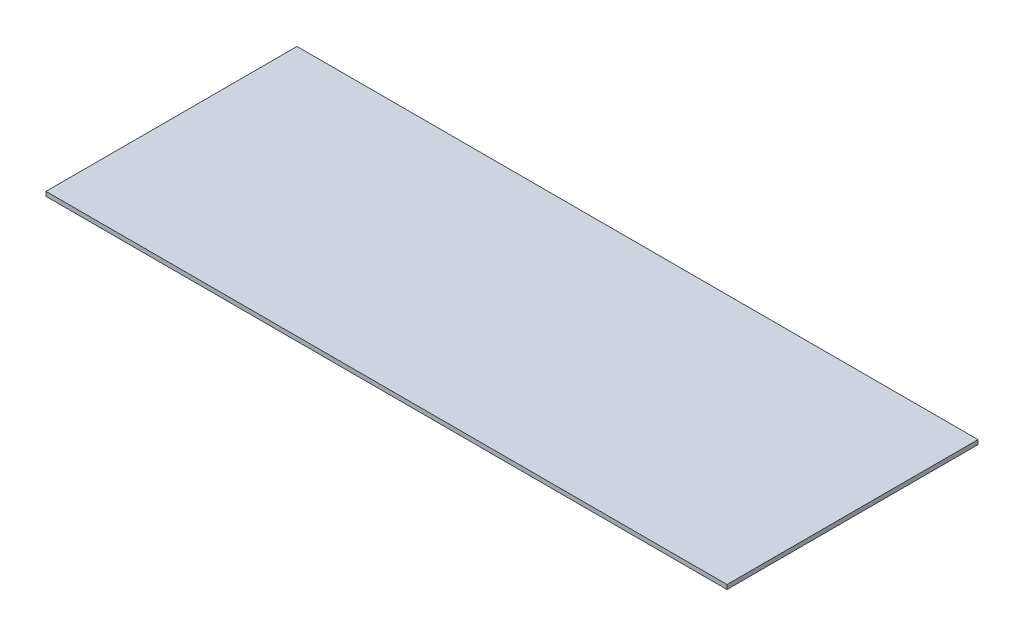
from build123d import *

# Parameters (mm, degrees)
SKETCH1_W           = 312
SKETCH1_H           = 115
BOSS_EXTRUDE1_DEPTH = 2


with BuildPart() as part:
    # Sketch1 → Boss-Extrude1 (new body)
    with BuildSketch(Plane(origin=(0, 0, 0), x_dir=(1, 0, 0), z_dir=(0, 1, 0))):
        with Locations((156, 57.5)):
            Rectangle(SKETCH1_W, SKETCH1_H)
    extrude(amount=BOSS_EXTRUDE1_DEPTH)


solid = part.part
